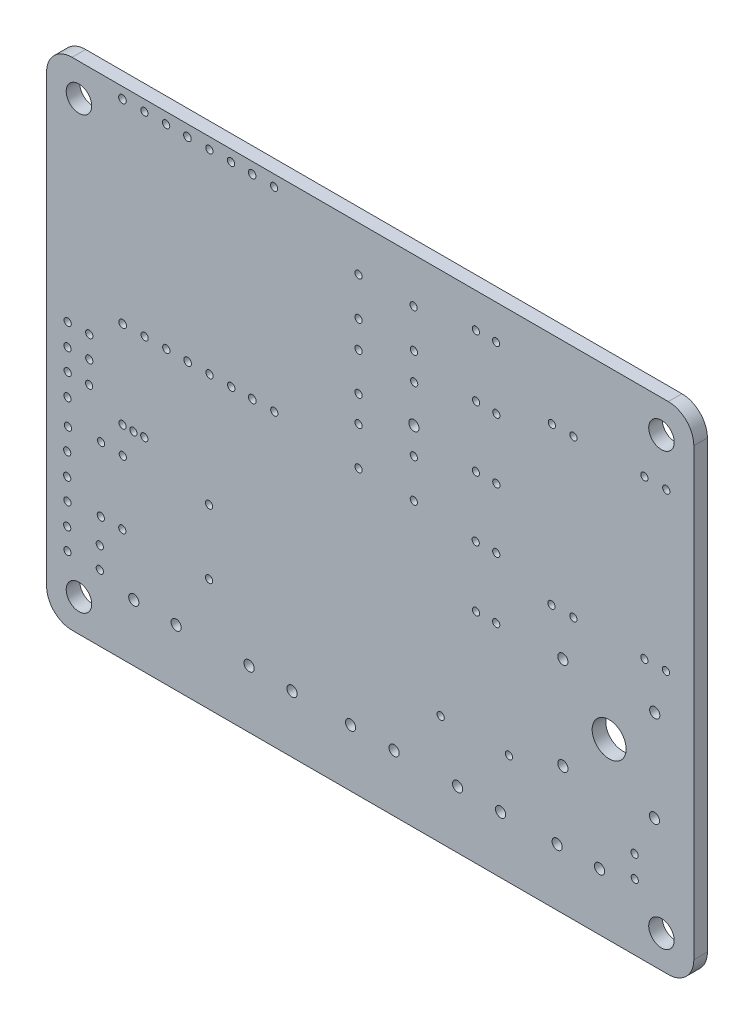
from build123d import *

# Parameters (mm, degrees)
ESQUISSE1_R        = 1.5
ESQUISSE1_R_2      = 0.449122519
ESQUISSE1_R_3      = 0.425258014
ESQUISSE1_R_4      = 0.43212249
ESQUISSE1_R_5      = 0.6
ESQUISSE1_R_6      = 2
BOSS_EXTRU_1_DEPTH = 1.6


with BuildPart() as part:
    # Esquisse1 → Boss.-Extru.1 (new body)
    with BuildSketch(Plane.XY):
        with BuildLine():
            Line((5.620364973, 58.899605158), (75.820364973, 58.899605158))
            ThreePointArc((75.820364973, 58.899605158), (77.941685316, 58.020925502), (78.820364973, 55.899605158))
            Line((78.820364973, 55.899605158), (78.820364973, 3.479605158))
            ThreePointArc((78.820364973, 3.479605158), (77.941685316, 1.358284815), (75.820364973, 0.479605158))
            Line((75.820364973, 0.479605158), (5.620364973, 0.479605158))
            ThreePointArc((5.620364973, 0.479605158), (3.499044629, 1.358284815), (2.620364973, 3.479605158))
            Line((2.620364973, 3.479605158), (2.620364973, 55.899605158))
            ThreePointArc((2.620364973, 55.899605158), (3.499044629, 58.020925502), (5.620364973, 58.899605158))
        make_face()
        with Locations((6.430364973, 55.089605158)):
            Circle(ESQUISSE1_R, mode=Mode.SUBTRACT)
        with Locations((75.010364973, 4.289605158)):
            Circle(ESQUISSE1_R, mode=Mode.SUBTRACT)
        with Locations((6.430364973, 4.289605158)):
            Circle(ESQUISSE1_R, mode=Mode.SUBTRACT)
        with Locations((75.010364973, 55.089605158)):
            Circle(ESQUISSE1_R, mode=Mode.SUBTRACT)
        with Locations((11.552831362, 57.615365404)):
            Circle(ESQUISSE1_R_2, mode=Mode.SUBTRACT)
        with Locations((14.1370916, 57.615365404)):
            Circle(ESQUISSE1_R_3, mode=Mode.SUBTRACT)
        with Locations((16.688639683, 57.615365404)):
            Circle(ESQUISSE1_R_4, mode=Mode.SUBTRACT)
        with Locations((19.199619548, 57.582653249)):
            Circle(ESQUISSE1_R_2, mode=Mode.SUBTRACT)
        with Locations((21.783879785, 57.582653249)):
            Circle(ESQUISSE1_R_3, mode=Mode.SUBTRACT)
        with Locations((24.335427868, 57.582653249)):
            Circle(ESQUISSE1_R_4, mode=Mode.SUBTRACT)
        with Locations((26.821551641, 57.582653249)):
            Circle(ESQUISSE1_R_2, mode=Mode.SUBTRACT)
        with Locations((29.405811879, 57.582653249)):
            Circle(ESQUISSE1_R_3, mode=Mode.SUBTRACT)
        with Locations((11.575035578, 34.708039908)):
            Circle(ESQUISSE1_R_2, mode=Mode.SUBTRACT)
        with Locations((14.159295816, 34.708039908)):
            Circle(ESQUISSE1_R_3, mode=Mode.SUBTRACT)
        with Locations((16.710843899, 34.708039908)):
            Circle(ESQUISSE1_R_4, mode=Mode.SUBTRACT)
        with Locations((19.221823764, 34.675327753)):
            Circle(ESQUISSE1_R_2, mode=Mode.SUBTRACT)
        with Locations((21.806084001, 34.675327753)):
            Circle(ESQUISSE1_R_3, mode=Mode.SUBTRACT)
        with Locations((24.357632084, 34.675327753)):
            Circle(ESQUISSE1_R_4, mode=Mode.SUBTRACT)
        with Locations((26.843755857, 34.675327753)):
            Circle(ESQUISSE1_R_2, mode=Mode.SUBTRACT)
        with Locations((29.428016095, 34.675327753)):
            Circle(ESQUISSE1_R_3, mode=Mode.SUBTRACT)
        with Locations((53.163306818, 54.832264293)):
            Circle(ESQUISSE1_R_3, mode=Mode.SUBTRACT)
        with Locations((55.540433341, 54.832264293)):
            Circle(ESQUISSE1_R_3, mode=Mode.SUBTRACT)
        with Locations((55.570147422, 47.522600237)):
            Circle(ESQUISSE1_R_3, mode=Mode.SUBTRACT)
        with Locations((53.1930209, 47.611742482)):
            Circle(ESQUISSE1_R_3, mode=Mode.SUBTRACT)
        with Locations((53.163306818, 40.420934752)):
            Circle(ESQUISSE1_R_3, mode=Mode.SUBTRACT)
        with Locations((55.570147422, 40.420934752)):
            Circle(ESQUISSE1_R_3, mode=Mode.SUBTRACT)
        with Locations((53.14142812, 33.298983102)):
            Circle(ESQUISSE1_R_3, mode=Mode.SUBTRACT)
        with Locations((55.557053239, 33.3399259)):
            Circle(ESQUISSE1_R_3, mode=Mode.SUBTRACT)
        with Locations((55.557053239, 26.17493614)):
            Circle(ESQUISSE1_R_3, mode=Mode.SUBTRACT)
        with Locations((53.182370918, 26.17493614)):
            Circle(ESQUISSE1_R_3, mode=Mode.SUBTRACT)
        with Locations((62.066958221, 31.292785969)):
            Circle(ESQUISSE1_R_3, mode=Mode.SUBTRACT)
        with Locations((64.646354535, 31.292785969)):
            Circle(ESQUISSE1_R_3, mode=Mode.SUBTRACT)
        with Locations((72.998685456, 31.25184317)):
            Circle(ESQUISSE1_R_3, mode=Mode.SUBTRACT)
        with Locations((75.537138971, 31.292785969)):
            Circle(ESQUISSE1_R_3, mode=Mode.SUBTRACT)
        with Locations((75.57808177, 49.79893095)):
            Circle(ESQUISSE1_R_3, mode=Mode.SUBTRACT)
        with Locations((72.998685456, 49.839873749)):
            Circle(ESQUISSE1_R_3, mode=Mode.SUBTRACT)
        with Locations((64.646354535, 49.757988152)):
            Circle(ESQUISSE1_R_3, mode=Mode.SUBTRACT)
        with Locations((62.10790102, 49.757988152)):
            Circle(ESQUISSE1_R_3, mode=Mode.SUBTRACT)
        with Locations((49.018752461, 13.440847602)):
            Circle(ESQUISSE1_R_3, mode=Mode.SUBTRACT)
        with Locations((57.05002029, 13.440847602)):
            Circle(ESQUISSE1_R_3, mode=Mode.SUBTRACT)
        with Locations((5.102916939, 31.656431458)):
            Circle(ESQUISSE1_R_3, mode=Mode.SUBTRACT)
        with Locations((7.643442377, 31.677780411)):
            Circle(ESQUISSE1_R_3, mode=Mode.SUBTRACT)
        with Locations((7.643442377, 29.115906021)):
            Circle(ESQUISSE1_R_3, mode=Mode.SUBTRACT)
        with Locations((7.622093423, 26.511333724)):
            Circle(ESQUISSE1_R_3, mode=Mode.SUBTRACT)
        with Locations((5.102916939, 26.55403163)):
            Circle(ESQUISSE1_R_3, mode=Mode.SUBTRACT)
        with Locations((5.081567986, 29.073208114)):
            Circle(ESQUISSE1_R_3, mode=Mode.SUBTRACT)
        with Locations((5.081567986, 23.970808287)):
            Circle(ESQUISSE1_R_3, mode=Mode.SUBTRACT)
        with Locations((11.56492709, 24.417750649)):
            Circle(ESQUISSE1_R_3, mode=Mode.SUBTRACT)
        with Locations((12.845140115, 24.358205857)):
            Circle(ESQUISSE1_R_3, mode=Mode.SUBTRACT)
        with Locations((14.12535314, 24.417750649)):
            Circle(ESQUISSE1_R_3, mode=Mode.SUBTRACT)
        with Locations((5.134089571, 20.993925117)):
            Circle(ESQUISSE1_R_3, mode=Mode.SUBTRACT)
        with Locations((5.044772383, 18.433499068)):
            Circle(ESQUISSE1_R_3, mode=Mode.SUBTRACT)
        with Locations((5.044772383, 15.843300623)):
            Circle(ESQUISSE1_R_3, mode=Mode.SUBTRACT)
        with Locations((5.074544779, 13.342419365)):
            Circle(ESQUISSE1_R_3, mode=Mode.SUBTRACT)
        with Locations((5.044772383, 10.781993316)):
            Circle(ESQUISSE1_R_3, mode=Mode.SUBTRACT)
        with Locations((5.074544779, 8.281112058)):
            Circle(ESQUISSE1_R_3, mode=Mode.SUBTRACT)
        with Locations((9.004501041, 13.759232908)):
            Circle(ESQUISSE1_R_3, mode=Mode.SUBTRACT)
        with Locations((9.034273437, 21.380966264)):
            Circle(ESQUISSE1_R_3, mode=Mode.SUBTRACT)
        with Locations((11.594699486, 21.261876681)):
            Circle(ESQUISSE1_R_3, mode=Mode.SUBTRACT)
        with Locations((21.747086496, 21.351193868)):
            Circle(ESQUISSE1_R_3, mode=Mode.SUBTRACT)
        with Locations((21.747086496, 13.759232908)):
            Circle(ESQUISSE1_R_3, mode=Mode.SUBTRACT)
        with Locations((11.535154694, 13.729460512)):
            Circle(ESQUISSE1_R_3, mode=Mode.SUBTRACT)
        with Locations((8.885411457, 10.781993316)):
            Circle(ESQUISSE1_R_3, mode=Mode.SUBTRACT)
        with Locations((8.885411457, 8.281112058)):
            Circle(ESQUISSE1_R_3, mode=Mode.SUBTRACT)
        with Locations((39.348557903, 53.619405616)):
            Circle(ESQUISSE1_R_3, mode=Mode.SUBTRACT)
        with Locations((45.83038937, 53.619405616)):
            Circle(ESQUISSE1_R_3, mode=Mode.SUBTRACT)
        with Locations((45.863629531, 49.09874367)):
            Circle(ESQUISSE1_R_3, mode=Mode.SUBTRACT)
        with Locations((39.348557903, 49.09874367)):
            Circle(ESQUISSE1_R_3, mode=Mode.SUBTRACT)
        with Locations((39.348557903, 45.94092834)):
            Circle(ESQUISSE1_R_3, mode=Mode.SUBTRACT)
        with Locations((45.896869692, 45.907688179)):
            Circle(ESQUISSE1_R_3, mode=Mode.SUBTRACT)
        with Locations((45.863629531, 41.486746717)):
            Circle(ESQUISSE1_R_5, mode=Mode.SUBTRACT)
        with Locations((39.348557903, 41.453506556)):
            Circle(ESQUISSE1_R_3, mode=Mode.SUBTRACT)
        with Locations((45.856335407, 38.34537897)):
            Circle(ESQUISSE1_R_3, mode=Mode.SUBTRACT)
        with Locations((39.350135574, 38.370943606)):
            Circle(ESQUISSE1_R_3, mode=Mode.SUBTRACT)
        with Locations((39.350135574, 33.858785372)):
            Circle(ESQUISSE1_R_3, mode=Mode.SUBTRACT)
        with Locations((45.856335407, 33.8076561)):
            Circle(ESQUISSE1_R_3, mode=Mode.SUBTRACT)
        with Locations((71.852738685, 10.806937061)):
            Circle(ESQUISSE1_R_3, mode=Mode.SUBTRACT)
        with Locations((71.870001894, 8.251982162)):
            Circle(ESQUISSE1_R_3, mode=Mode.SUBTRACT)
        with Locations((12.887042224, 7.217406275)):
            Circle(ESQUISSE1_R_5, mode=Mode.SUBTRACT)
        with Locations((17.87612986, 7.160279318)):
            Circle(ESQUISSE1_R_5, mode=Mode.SUBTRACT)
        with Locations((26.461748825, 7.28752809)):
            Circle(ESQUISSE1_R_5, mode=Mode.SUBTRACT)
        with Locations((31.521661116, 7.222238899)):
            Circle(ESQUISSE1_R_5, mode=Mode.SUBTRACT)
        with Locations((38.409670751, 7.222238899)):
            Circle(ESQUISSE1_R_5, mode=Mode.SUBTRACT)
        with Locations((43.534872233, 7.189594304)):
            Circle(ESQUISSE1_R_5, mode=Mode.SUBTRACT)
        with Locations((51.010484586, 7.254883494)):
            Circle(ESQUISSE1_R_5, mode=Mode.SUBTRACT)
        with Locations((56.070396878, 7.189594304)):
            Circle(ESQUISSE1_R_5, mode=Mode.SUBTRACT)
        with Locations((62.729894345, 7.222238899)):
            Circle(ESQUISSE1_R_5, mode=Mode.SUBTRACT)
        with Locations((67.724517445, 7.222238899)):
            Circle(ESQUISSE1_R_5, mode=Mode.SUBTRACT)
        with Locations((63.404629266, 26.427964058)):
            Circle(ESQUISSE1_R_5, mode=Mode.SUBTRACT)
        with Locations((74.222112873, 26.389874327)):
            Circle(ESQUISSE1_R_5, mode=Mode.SUBTRACT)
        with Locations((74.184023142, 15.610480451)):
            Circle(ESQUISSE1_R_5, mode=Mode.SUBTRACT)
        with Locations((63.404629266, 15.534300989)):
            Circle(ESQUISSE1_R_5, mode=Mode.SUBTRACT)
        with Locations((68.851460801, 20.981132523)):
            Circle(ESQUISSE1_R_6, mode=Mode.SUBTRACT)
    extrude(amount=BOSS_EXTRU_1_DEPTH)


solid = part.part
